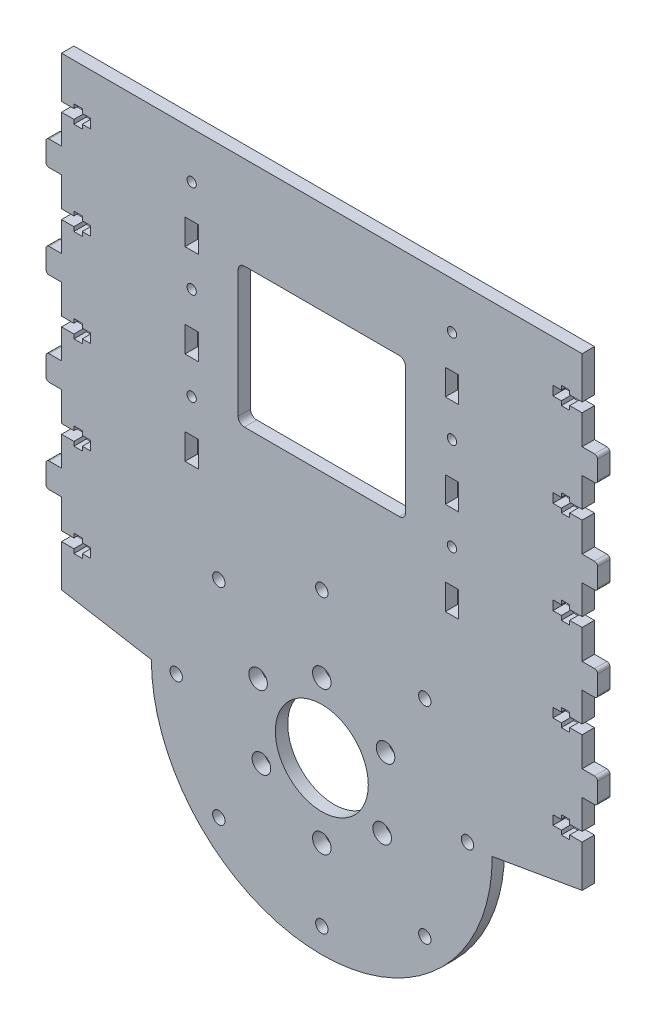
from build123d import *

# Parameters (mm, degrees)
SKETCH_1_R      = 1.5
SKETCH_1_R_2    = 3
SKETCH_1_R_3    = 15
SKETCH_1_R_4    = 2
SKETCH_1_W      = 4.3
SKETCH_1_H      = 8.3
SKETCH_1_W_2    = 54
SKETCH_1_H_2    = 45
EXTRUDE_1_DEPTH = 4
FILLET_1_R      = 1
FILLET_2_R      = 2


with BuildPart() as part:
    # 草图1 → 凸台-拉伸1 (new body)
    with BuildSketch(Plane.XY):
        with BuildLine():
            Line((145, 46.5), (149, 46.5))
            Line((149, 46.5), (149, 45.15))
            Line((149, 45.15), (151.7, 45.15))
            Line((151.7, 45.15), (151.7, 46.5))
            Line((151.7, 46.5), (154.4, 46.5))
            Line((154.4, 46.5), (154.4, 49.5))
            Line((154.4, 49.5), (151.7, 49.5))
            Line((151.7, 49.5), (151.7, 50.85))
            Line((151.7, 50.85), (149, 50.85))
            Line((149, 50.85), (149, 49.5))
            Line((149, 49.5), (145, 49.5))
            Line((145, 49.5), (145, 59))
            Line((145, 59), (140, 59))
            Line((140, 59), (140, 67))
            Line((140, 67), (145, 67))
            Line((145, 67), (145, 76.5))
            Line((145, 76.5), (149, 76.5))
            Line((149, 76.5), (149, 75.15))
            Line((149, 75.15), (151.7, 75.15))
            Line((151.7, 75.15), (151.7, 76.5))
            Line((151.7, 76.5), (154.4, 76.5))
            Line((154.4, 76.5), (154.4, 79.5))
            Line((154.4, 79.5), (151.7, 79.5))
            Line((151.7, 79.5), (151.7, 80.85))
            Line((151.7, 80.85), (149, 80.85))
            Line((149, 80.85), (149, 79.5))
            Line((149, 79.5), (145, 79.5))
            Line((145, 79.5), (145, 89))
            Line((145, 89), (140, 89))
            Line((140, 89), (140, 97))
            Line((140, 97), (145, 97))
            Line((145, 97), (145, 106.5))
            Line((145, 106.5), (149, 106.5))
            Line((149, 106.5), (149, 105.15))
            Line((149, 105.15), (151.7, 105.15))
            Line((151.7, 105.15), (151.7, 106.5))
            Line((151.7, 106.5), (154.4, 106.5))
            Line((154.4, 106.5), (154.4, 109.5))
            Line((154.4, 109.5), (151.7, 109.5))
            Line((151.7, 109.5), (151.7, 110.85))
            Line((151.7, 110.85), (149, 110.85))
            Line((149, 110.85), (149, 109.5))
            Line((149, 109.5), (145, 109.5))
            Line((145, 109.5), (145, 123))
            Line((145, 123), (313, 123))
            Line((313, 123), (313, 109.5))
            Line((313, 109.5), (309, 109.5))
            Line((309, 109.5), (309, 110.85))
            Line((309, 110.85), (306.3, 110.85))
            Line((306.3, 110.85), (306.3, 109.5))
            Line((306.3, 109.5), (303.6, 109.5))
            Line((303.6, 109.5), (303.6, 106.5))
            Line((303.6, 106.5), (306.3, 106.5))
            Line((306.3, 106.5), (306.3, 105.15))
            Line((306.3, 105.15), (309, 105.15))
            Line((309, 105.15), (309, 106.5))
            Line((309, 106.5), (313, 106.5))
            Line((313, 106.5), (313, 97))
            Line((313, 97), (318, 97))
            Line((318, 97), (318, 89))
            Line((318, 89), (313, 89))
            Line((313, 89), (313, 79.5))
            Line((313, 79.5), (309, 79.5))
            Line((309, 79.5), (309, 80.85))
            Line((309, 80.85), (306.3, 80.85))
            Line((306.3, 80.85), (306.3, 79.5))
            Line((306.3, 79.5), (303.6, 79.5))
            Line((303.6, 79.5), (303.6, 76.5))
            Line((303.6, 76.5), (306.3, 76.5))
            Line((306.3, 76.5), (306.3, 75.15))
            Line((306.3, 75.15), (309, 75.15))
            Line((309, 75.15), (309, 76.5))
            Line((309, 76.5), (313, 76.5))
            Line((313, 76.5), (313, 67))
            Line((313, 67), (318, 67))
            Line((318, 67), (318, 59))
            Line((318, 59), (313, 59))
            Line((313, 59), (313, 49.5))
            Line((313, 49.5), (309, 49.5))
            Line((309, 49.5), (309, 50.85))
            Line((309, 50.85), (306.3, 50.85))
            Line((306.3, 50.85), (306.3, 49.5))
            Line((306.3, 49.5), (303.6, 49.5))
            Line((303.6, 49.5), (303.6, 46.5))
            Line((303.6, 46.5), (306.3, 46.5))
            Line((306.3, 46.5), (306.3, 45.15))
            Line((306.3, 45.15), (309, 45.15))
            Line((309, 45.15), (309, 46.5))
            Line((309, 46.5), (313, 46.5))
            Line((313, 46.5), (313, 37))
            Line((313, 37), (318, 37))
            Line((318, 37), (318, 29))
            Line((318, 29), (313, 29))
            Line((313, 29), (313, 19.5))
            Line((313, 19.5), (309, 19.5))
            Line((309, 19.5), (309, 20.85))
            Line((309, 20.85), (306.3, 20.85))
            Line((306.3, 20.85), (306.3, 19.5))
            Line((306.3, 19.5), (303.6, 19.5))
            Line((303.6, 19.5), (303.6, 16.5))
            Line((303.6, 16.5), (306.3, 16.5))
            Line((306.3, 16.5), (306.3, 15.15))
            Line((306.3, 15.15), (309, 15.15))
            Line((309, 15.15), (309, 16.5))
            Line((309, 16.5), (313, 16.5))
            Line((313, 16.5), (313, 7))
            Line((313, 7), (318, 7))
            Line((318, 7), (318, -1))
            Line((318, -1), (313, -1))
            Line((313, -1), (313, -10.5))
            Line((313, -10.5), (309, -10.5))
            Line((309, -10.5), (309, -9.15))
            Line((309, -9.15), (306.3, -9.15))
            Line((306.3, -9.15), (306.3, -10.5))
            Line((306.3, -10.5), (303.6, -10.5))
            Line((303.6, -10.5), (303.6, -13.5))
            Line((303.6, -13.5), (306.3, -13.5))
            Line((306.3, -13.5), (306.3, -14.85))
            Line((306.3, -14.85), (309, -14.85))
            Line((309, -14.85), (309, -13.5))
            Line((309, -13.5), (313, -13.5))
            Line((313, -13.5), (313, -27))
            Line((313, -27), (284, -32))
            ThreePointArc((284, -32), (229, -87), (174, -32))
            Line((174, -32), (145, -27))
            Line((145, -27), (145, -13.5))
            Line((145, -13.5), (149, -13.5))
            Line((149, -13.5), (149, -14.85))
            Line((149, -14.85), (151.7, -14.85))
            Line((151.7, -14.85), (151.7, -13.5))
            Line((151.7, -13.5), (154.4, -13.5))
            Line((154.4, -13.5), (154.4, -10.5))
            Line((154.4, -10.5), (151.7, -10.5))
            Line((151.7, -10.5), (151.7, -9.15))
            Line((151.7, -9.15), (149, -9.15))
            Line((149, -9.15), (149, -10.5))
            Line((149, -10.5), (145, -10.5))
            Line((145, -10.5), (145, -1))
            Line((145, -1), (140, -1))
            Line((140, -1), (140, 7))
            Line((140, 7), (145, 7))
            Line((145, 7), (145, 16.5))
            Line((145, 16.5), (149, 16.5))
            Line((149, 16.5), (149, 15.15))
            Line((149, 15.15), (151.7, 15.15))
            Line((151.7, 15.15), (151.7, 16.5))
            Line((151.7, 16.5), (154.4, 16.5))
            Line((154.4, 16.5), (154.4, 19.5))
            Line((154.4, 19.5), (151.7, 19.5))
            Line((151.7, 19.5), (151.7, 20.85))
            Line((151.7, 20.85), (149, 20.85))
            Line((149, 20.85), (149, 19.5))
            Line((149, 19.5), (145, 19.5))
            Line((145, 19.5), (145, 29))
            Line((145, 29), (140, 29))
            Line((140, 29), (140, 37))
            Line((140, 37), (145, 37))
            Line((145, 37), (145, 46.5))
        make_face()
        with Locations((187, 108)):
            Circle(SKETCH_1_R, mode=Mode.SUBTRACT)
        with Locations((229, -55.75)):
            Circle(SKETCH_1_R_2, mode=Mode.SUBTRACT)
        with Locations((248.485571585, -43.25)):
            Circle(SKETCH_1_R_2, mode=Mode.SUBTRACT)
        with Locations((229, -32)):
            Circle(SKETCH_1_R_3, mode=Mode.SUBTRACT)
        with Locations((276, -32)):
            Circle(SKETCH_1_R_4, mode=Mode.SUBTRACT)
        with Locations((208.43189666, -20.125)):
            Circle(SKETCH_1_R_2, mode=Mode.SUBTRACT)
        with Locations((249.56810334, -20.125)):
            Circle(SKETCH_1_R_2, mode=Mode.SUBTRACT)
        with Locations((209.514428415, -43.25)):
            Circle(SKETCH_1_R_2, mode=Mode.SUBTRACT)
        with Locations((229, -9.5)):
            Circle(SKETCH_1_R_2, mode=Mode.SUBTRACT)
        with Locations((187, 78)):
            Circle(SKETCH_1_R, mode=Mode.SUBTRACT)
        with Locations((187, 48)):
            Circle(SKETCH_1_R, mode=Mode.SUBTRACT)
        with Locations((271, 48)):
            Circle(SKETCH_1_R, mode=Mode.SUBTRACT)
        with Locations((271, 78)):
            Circle(SKETCH_1_R, mode=Mode.SUBTRACT)
        with Locations((271, 108)):
            Circle(SKETCH_1_R, mode=Mode.SUBTRACT)
        with Locations((262.234018716, -65.234018716)):
            Circle(SKETCH_1_R_4, mode=Mode.SUBTRACT)
        with Locations((229, -79)):
            Circle(SKETCH_1_R_4, mode=Mode.SUBTRACT)
        with Locations((195.765981284, -65.234018716)):
            Circle(SKETCH_1_R_4, mode=Mode.SUBTRACT)
        with Locations((182, -32)):
            Circle(SKETCH_1_R_4, mode=Mode.SUBTRACT)
        with Locations((195.765981284, 1.234018716)):
            Circle(SKETCH_1_R_4, mode=Mode.SUBTRACT)
        with Locations((229, 15)):
            Circle(SKETCH_1_R_4, mode=Mode.SUBTRACT)
        with Locations((262.234018716, 1.234018716)):
            Circle(SKETCH_1_R_4, mode=Mode.SUBTRACT)
        with Locations((187, 93)):
            Rectangle(SKETCH_1_W, SKETCH_1_H, mode=Mode.SUBTRACT)
        with Locations((187, 63)):
            Rectangle(SKETCH_1_W, SKETCH_1_H, mode=Mode.SUBTRACT)
        with Locations((271, 63)):
            Rectangle(SKETCH_1_W, SKETCH_1_H, mode=Mode.SUBTRACT)
        with Locations((271, 93)):
            Rectangle(SKETCH_1_W, SKETCH_1_H, mode=Mode.SUBTRACT)
        with Locations((187, 33)):
            Rectangle(SKETCH_1_W, SKETCH_1_H, mode=Mode.SUBTRACT)
        with Locations((271, 33)):
            Rectangle(SKETCH_1_W, SKETCH_1_H, mode=Mode.SUBTRACT)
        with Locations((229, 70.5)):
            Rectangle(SKETCH_1_W_2, SKETCH_1_H_2, mode=Mode.SUBTRACT)
    extrude(amount=EXTRUDE_1_DEPTH)

    # 圆角1
    fillet_1_edges = [part.edges().sort_by_distance(p)[0] for p in [
        (140, -1, 2),
        (140, 7, 2),
        (140, 29, 2),
        (140, 37, 2),
        (140, 59, 2),
        (140, 67, 2),
        (140, 89, 2),
        (140, 97, 2),
        (318, 97, 2),
        (318, 89, 2),
        (318, 67, 2),
        (318, 59, 2),
        (318, 37, 2),
        (318, 29, 2),
        (318, 7, 2),
        (318, -1, 2),
    ]]
    fillet(fillet_1_edges, radius=FILLET_1_R)

    # 圆角2
    fillet_2_edges = [part.edges().sort_by_distance(p)[0] for p in [
        (202, 48, 2),
        (256, 48, 2),
        (256, 93, 2),
        (202, 93, 2),
    ]]
    fillet(fillet_2_edges, radius=FILLET_2_R)


solid = part.part
